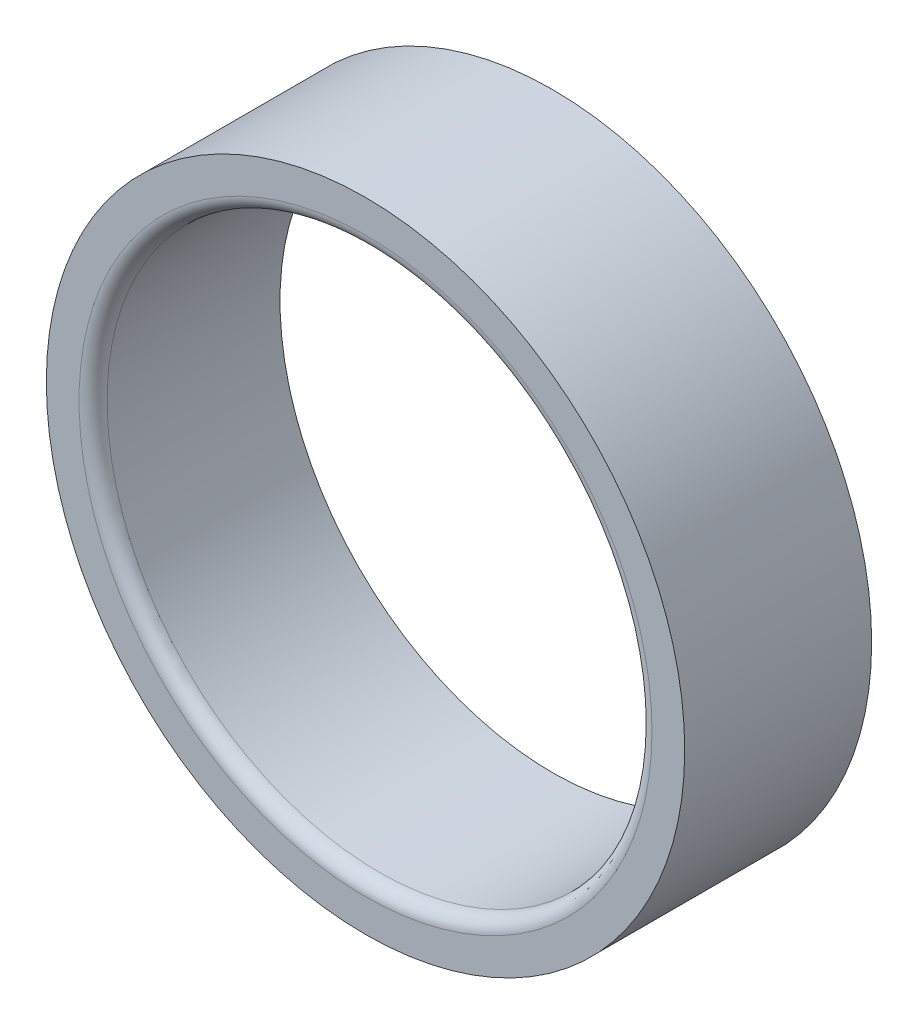
from build123d import *

# Parameters (mm, degrees)
SKETCH1_R           = 34.15
SKETCH1_R_2         = 29.15
BOSS_EXTRUDE1_DEPTH = 20
FILLET1_R           = 1.5


with BuildPart() as part:
    # Sketch1 → Boss-Extrude1 (new body)
    with BuildSketch(Plane.XY):
        Circle(SKETCH1_R)
        Circle(SKETCH1_R_2, mode=Mode.SUBTRACT)
    extrude(amount=BOSS_EXTRUDE1_DEPTH)

    # Fillet1
    fillet1_edges = [part.edges().sort_by_distance(p)[0] for p in [
        (-29.15, 0, 20),
    ]]
    fillet(fillet1_edges, radius=FILLET1_R)


solid = part.part
